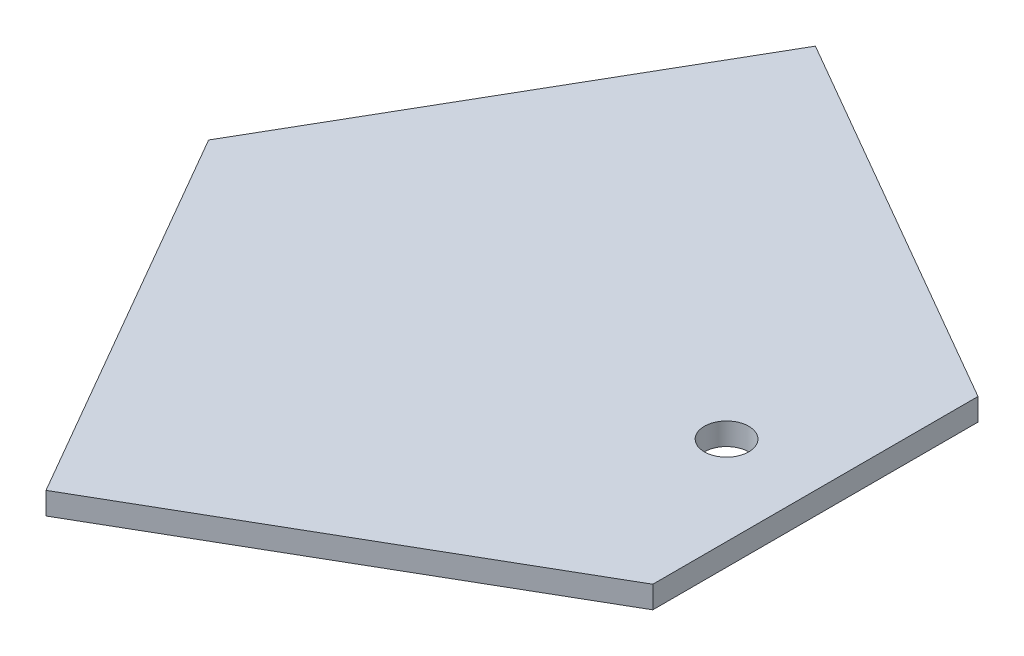
from build123d import *

# Parameters (mm, degrees)
BOSS_EXTRU_1_DEPTH      = 5
ESQUISSE2_R             = 5
ENL_V_MAT_EXTRU_1_DEPTH = 10


with BuildPart() as part:
    # Esquisse1 → Boss.-Extru.1 (new body)
    with BuildSketch(Plane(origin=(0, 0, 0), x_dir=(1, 0, 0), z_dir=(0, 1, 0))):
        Polygon((0, 0), (50, -86.602540378), (136.602540378, -36.602540378), (136.602540378, 36.602540378), (50, 86.602540378), align=None)
    extrude(amount=BOSS_EXTRU_1_DEPTH)

    # Esquisse2 → Enlèv. mat.-Extru.1 (cut)
    with BuildSketch(Plane(origin=(0, 5, 0), x_dir=(1, 0, 0), z_dir=(0, 1, 0))):
        with Locations(Location((116.602540378, 0, 0), (0, 0, 270))):
            Circle(ESQUISSE2_R)
    extrude(amount=-ENL_V_MAT_EXTRU_1_DEPTH, mode=Mode.SUBTRACT)


solid = part.part
